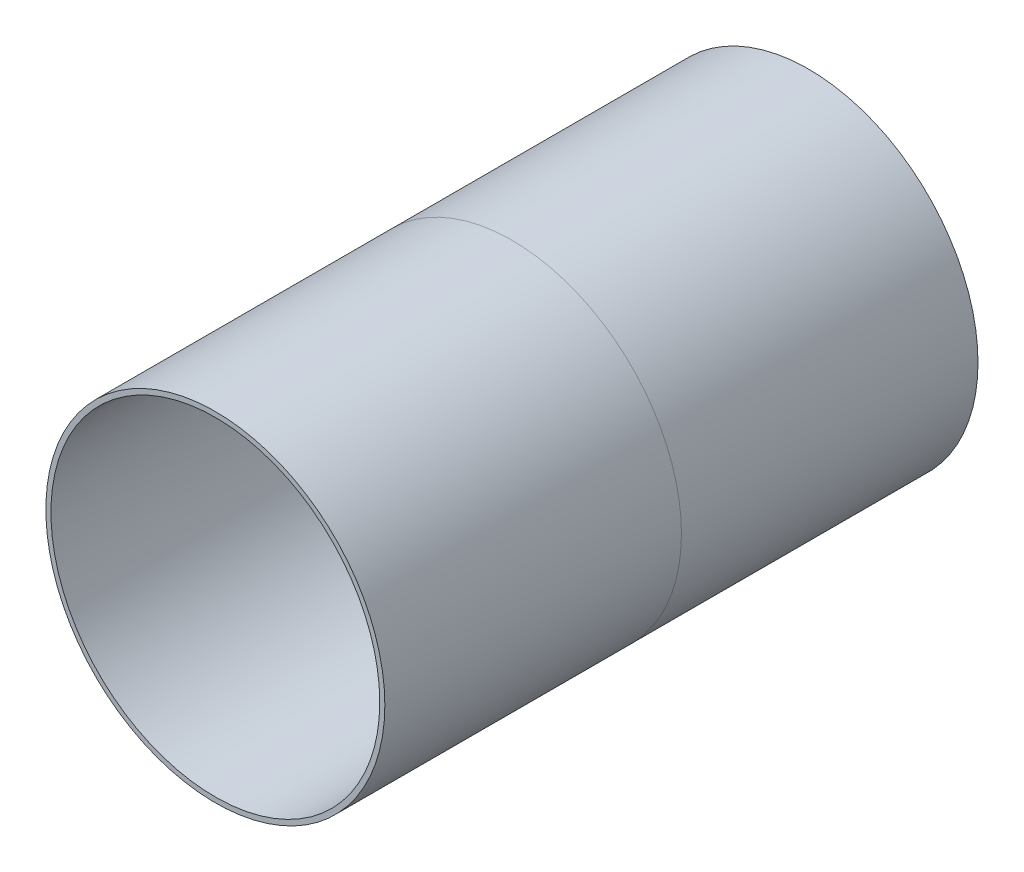
from build123d import *

# Parameters (mm, degrees)
ESQUISSE2_R        = 76.1746
ESQUISSE2_R_2      = 73.914
BOSS_EXTRU_1_DEPTH = 133.35
ESQUISSE3_R        = 76.2
ESQUISSE3_R_2      = 73.914
BOSS_EXTRU_2_DEPTH = 133.35


with BuildPart() as part:
    # Esquisse2 → Boss.-Extru.1 (new body)
    with BuildSketch(Plane.XY):
        Circle(ESQUISSE2_R)
        Circle(ESQUISSE2_R_2, mode=Mode.SUBTRACT)
    extrude(amount=BOSS_EXTRU_1_DEPTH)

    # Esquisse3 → Boss.-Extru.2 (add)
    with BuildSketch(Plane.XY.offset(133.35)):
        Circle(ESQUISSE3_R)
        Circle(ESQUISSE3_R_2, mode=Mode.SUBTRACT)
    extrude(amount=BOSS_EXTRU_2_DEPTH)


solid = part.part
